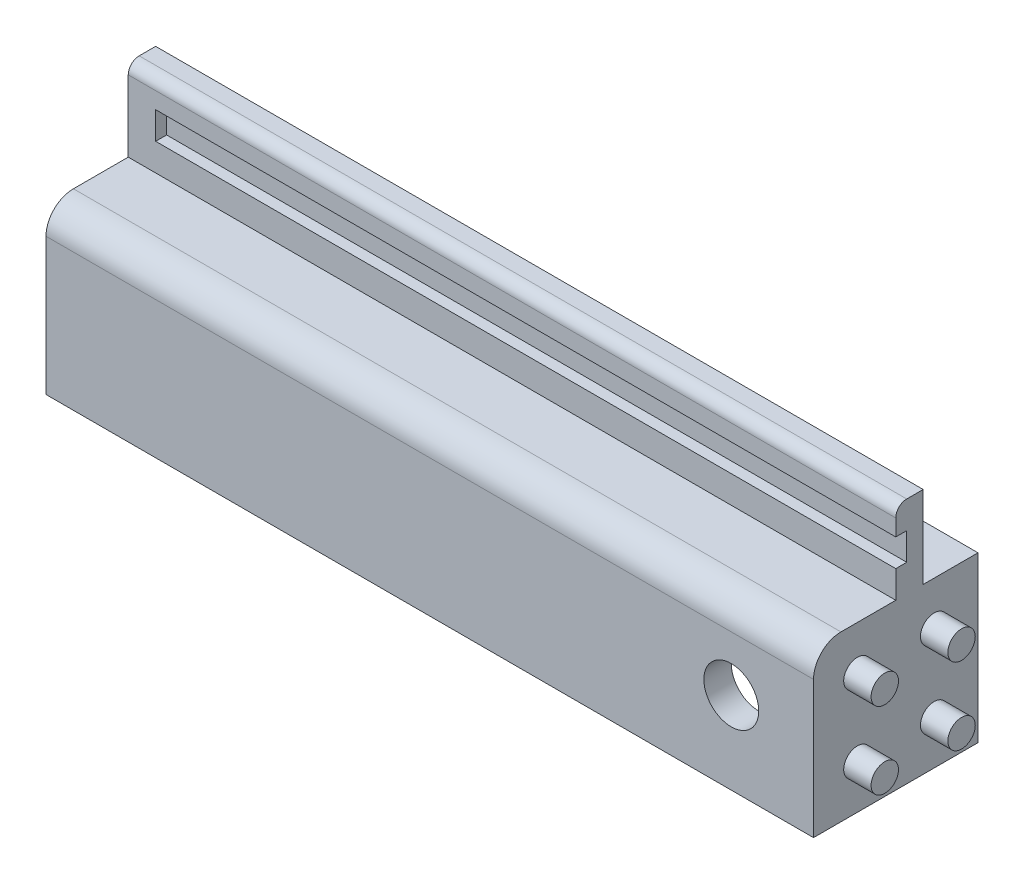
from build123d import *

# Parameters (mm, degrees)
SKETCH1_W                                       = 140
SKETCH1_H                                       = 30
BOSS_EXTRUDE1_DEPTH                             = 30
SHELL1_T                                        = -5
SKETCH3_W                                       = 5
SKETCH3_H                                       = 20
BOSS_EXTRUDE2_DEPTH                             = 25
SKETCH4_R                                       = 2.5
BOSS_EXTRUDE3_DEPTH                             = 5
SKETCH5_R                                       = 1.5
CUT_EXTRUDE1_DEPTH                              = 20
CUT_EXTRUDE2_DEPTH                              = 152.079449297
CUT_EXTRUDE2_DEPTH_BACK                         = 152.079449297
SKETCH9_R                                       = 5
SKETCH10_W                                      = 140
SKETCH10_H                                      = 5
BOSS_EXTRUDE5_DEPTH                             = 15
SKETCH11_W                                      = 135
SKETCH11_H                                      = 5
CUT_EXTRUDE3_DEPTH                              = 2
FILLET1_R                                       = 2
CSK_FOR_M5_FLAT_HEAD_MACHINE_SCREW1_D           = 5.5
CSK_FOR_M5_FLAT_HEAD_MACHINE_SCREW1_DEPTH       = 20
CSK_FOR_M5_FLAT_HEAD_MACHINE_SCREW1_CSINK_D     = 10.4
CSK_FOR_M5_FLAT_HEAD_MACHINE_SCREW1_CSINK_ANGLE = 90
CSK_FOR_M5_FLAT_HEAD_MACHINE_SCREW1_TIP         = 1.652366702
FILLET2_R                                       = 5


with BuildPart() as part:
    # Sketch1 → Boss-Extrude1 (new body)
    with BuildSketch(Plane(origin=(0, 0, 0), x_dir=(1, 0, 0), z_dir=(0, 1, 0))):
        with Locations((70, 15)):
            Rectangle(SKETCH1_W, SKETCH1_H)
    extrude(amount=BOSS_EXTRUDE1_DEPTH)

    # Shell1
    shell1_openings = [part.faces().sort_by_distance(p)[0] for p in [
        (70, 0, -15),
    ]]
    offset(amount=SHELL1_T, openings=shell1_openings, kind=Kind.INTERSECTION)

    # Sketch3 → Boss-Extrude2 (add)
    with BuildSketch(Plane.XZ.offset(-25)):
        with Locations((52.5, -15)):
            Rectangle(SKETCH3_W, SKETCH3_H)
    extrude(amount=BOSS_EXTRUDE2_DEPTH)

    # Sketch4 → Boss-Extrude3 (add)
    with BuildSketch(Plane(origin=(140, 0, 0), x_dir=(0, 0, -1), z_dir=(1, 0, 0))):
        with Locations(Location((8, 22, 0), (0, 0, 180))):
            Circle(SKETCH4_R)
        with Locations(Location((22, 22, 0), (0, 0, 180))):
            Circle(SKETCH4_R)
        with Locations(Location((8, 8, 0), (0, 0, 180))):
            Circle(SKETCH4_R)
        with Locations(Location((22, 8, 0), (0, 0, 180))):
            Circle(SKETCH4_R)
    extrude(amount=BOSS_EXTRUDE3_DEPTH)

    # Sketch5 → Cut-Extrude1 (cut)
    with BuildSketch(Plane.ZY):
        with Locations((-15, 15)):
            Circle(SKETCH5_R)
    extrude(amount=-CUT_EXTRUDE1_DEPTH, mode=Mode.SUBTRACT)

    # Sketch9 → Cut-Extrude2 (cut, two sides: drawn at the far end of the back side and taken through both)
    with BuildSketch(Plane.XY.offset(-CUT_EXTRUDE2_DEPTH_BACK)):
        with Locations((125, 15)):
            Circle(SKETCH9_R)
    extrude(amount=CUT_EXTRUDE2_DEPTH + CUT_EXTRUDE2_DEPTH_BACK, mode=Mode.SUBTRACT)

    # Sketch10 → Boss-Extrude5 (add)
    with BuildSketch(Plane(origin=(0, 30, 0), x_dir=(1, 0, 0), z_dir=(0, 1, 0))):
        with Locations((70, 17.5)):
            Rectangle(SKETCH10_W, SKETCH10_H)
    extrude(amount=BOSS_EXTRUDE5_DEPTH)

    # Sketch11 → Cut-Extrude3 (cut)
    with BuildSketch(Plane.XY.offset(-15)):
        with Locations((72.5, 37.5)):
            Rectangle(SKETCH11_W, SKETCH11_H)
    extrude(amount=-CUT_EXTRUDE3_DEPTH, mode=Mode.SUBTRACT)

    # Fillet1
    fillet1_edges = [part.edges().sort_by_distance(p)[0] for p in [
        (70, 45, -15),
    ]]
    fillet(fillet1_edges, radius=FILLET1_R)

    # CSK for M5 Flat Head Machine Screw1
    with Locations(Plane.ZY):
        with Locations((-15, 15)):
            CounterSinkHole(CSK_FOR_M5_FLAT_HEAD_MACHINE_SCREW1_D / 2, CSK_FOR_M5_FLAT_HEAD_MACHINE_SCREW1_CSINK_D / 2, depth=CSK_FOR_M5_FLAT_HEAD_MACHINE_SCREW1_DEPTH, counter_sink_angle=CSK_FOR_M5_FLAT_HEAD_MACHINE_SCREW1_CSINK_ANGLE)
            with Locations((0, 0, -(CSK_FOR_M5_FLAT_HEAD_MACHINE_SCREW1_DEPTH + CSK_FOR_M5_FLAT_HEAD_MACHINE_SCREW1_TIP / 2))):  # 118° drill point
                Cone(0, CSK_FOR_M5_FLAT_HEAD_MACHINE_SCREW1_D / 2, CSK_FOR_M5_FLAT_HEAD_MACHINE_SCREW1_TIP, mode=Mode.SUBTRACT)

    # Fillet2
    fillet2_edges = [part.edges().sort_by_distance(p)[0] for p in [
        (70, 30, 0),
    ]]
    fillet(fillet2_edges, radius=FILLET2_R)


solid = part.part
